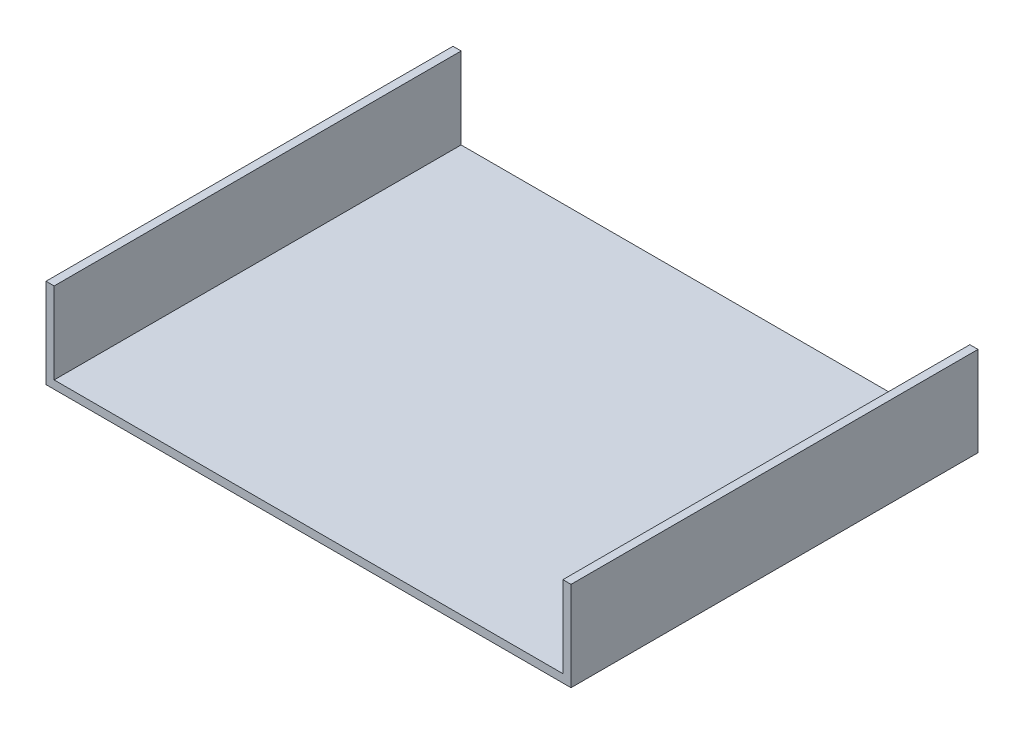
from build123d import *

# Parameters (mm, degrees)
BOSS_EXTRUDE1_DEPTH = 10000


with BuildPart() as part:
    # Sketch1 → Boss-Extrude1 (new body)
    with BuildSketch(Plane.XY):
        Polygon((0, 0), (0, -2000), (12500, -2000), (12500, 0), (12700, 0), (12700, -2200), (-200, -2200), (-200, 0), align=None)
    extrude(amount=BOSS_EXTRUDE1_DEPTH)


solid = part.part
